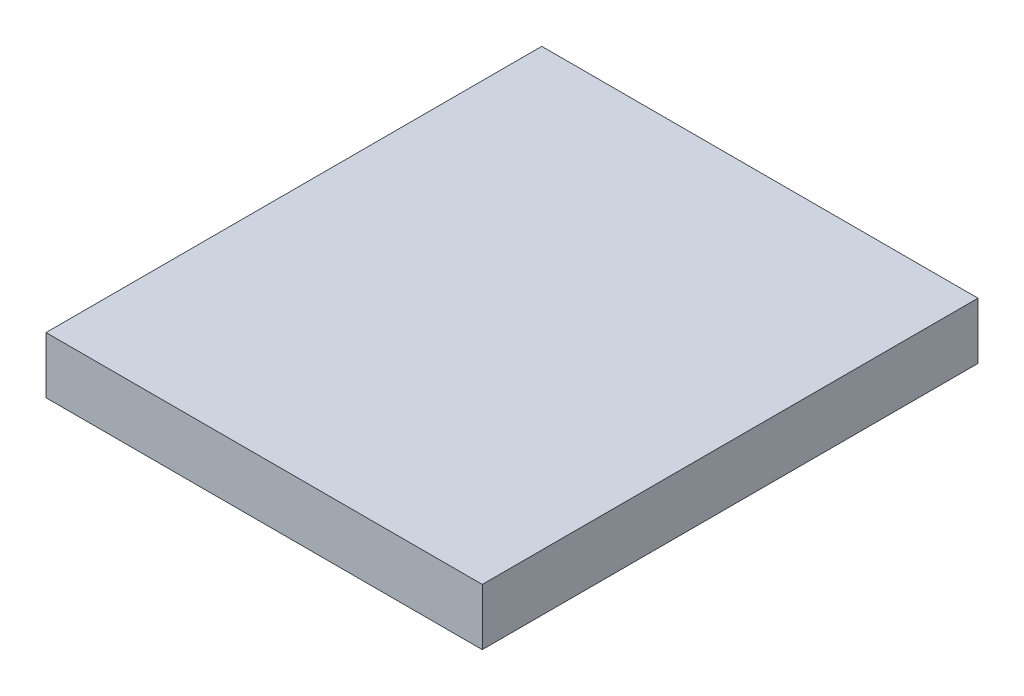
from build123d import *

# Parameters (mm, degrees)
SKETCH1_W           = 22
SKETCH1_H           = 25
BOSS_EXTRUDE1_DEPTH = 2.85


with BuildPart() as part:
    # Sketch1 → Boss-Extrude1 (new body)
    with BuildSketch(Plane(origin=(0, 0, 0), x_dir=(1, 0, 0), z_dir=(0, 1, 0))):
        with Locations((11, 12.5)):
            Rectangle(SKETCH1_W, SKETCH1_H)
    extrude(amount=BOSS_EXTRUDE1_DEPTH)


solid = part.part
